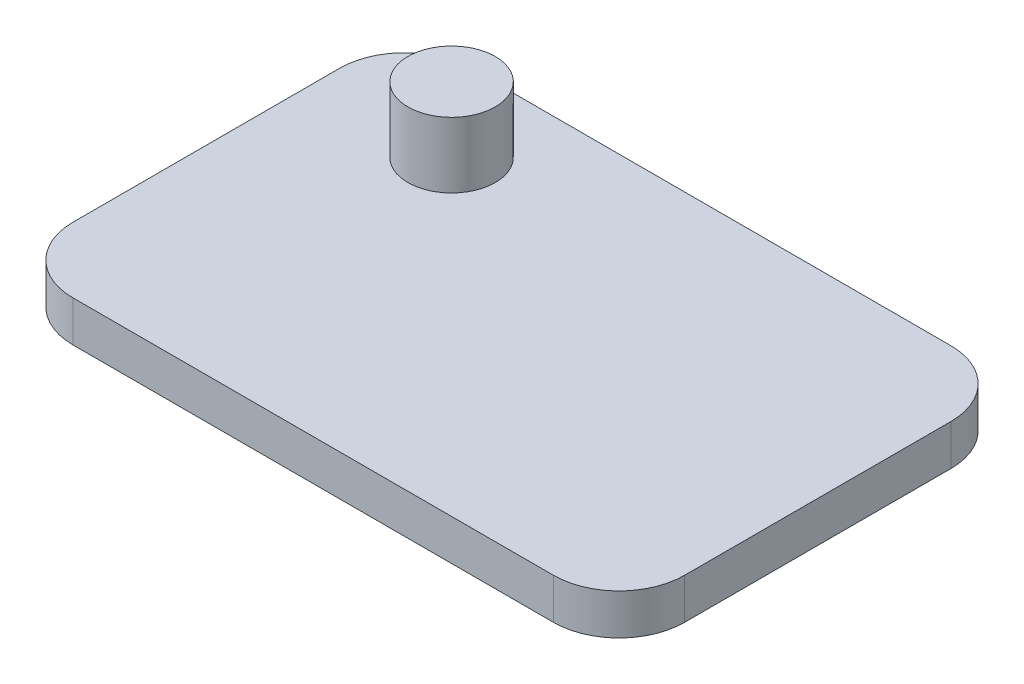
from build123d import *

# Parameters (mm, degrees)
SKETCH1_W           = 1422.4
SKETCH1_H           = 924.56
BOSS_EXTRUDE1_DEPTH = 94.826666667
FILLET1_R           = 152.4
SKETCH1_3_R         = 101.6
BOSS_EXTRUDE2_DEPTH = 152.4


with BuildPart() as part:
    # Sketch1 → Boss-Extrude1 (new body)
    with BuildSketch(Plane(origin=(0, 0, 0), x_dir=(1, 0, 0), z_dir=(0, 1, 0))):
        Rectangle(SKETCH1_W, SKETCH1_H)
    extrude(amount=-BOSS_EXTRUDE1_DEPTH)

    # Fillet1
    fillet1_edges = [part.edges().sort_by_distance(p)[0] for p in [
        (-711.2, -47.413333333, -462.28),
        (711.2, -47.413333333, -462.28),
        (711.2, -47.413333333, 462.28),
        (-711.2, -47.413333333, 462.28),
    ]]
    fillet(fillet1_edges, radius=FILLET1_R)

    # Sketch1<3> → Boss-Extrude2 (add)
    with BuildSketch(Plane(origin=(0, 0, 0), x_dir=(1, 0, 0), z_dir=(0, 1, 0))):
        with Locations((-401.553909641, 261.010041267)):
            Circle(SKETCH1_3_R)
    extrude(amount=BOSS_EXTRUDE2_DEPTH)


solid = part.part
